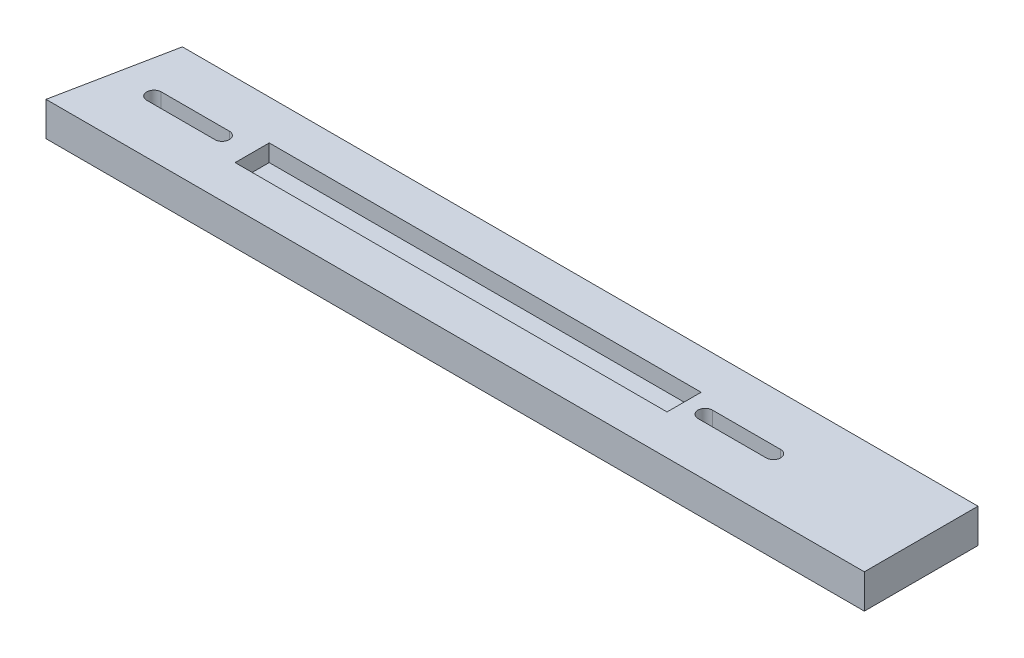
from build123d import *

# Parameters (mm, degrees)
SKETCH1_W           = 457.2
SKETCH1_H           = 63.5
BOSS_EXTRUDE1_DEPTH = 19.05
CUT_EXTRUDE1_DEPTH  = 19.05
CUT_EXTRUDE2_DEPTH  = 232.579198116
SKETCH5_W           = 241.3
SKETCH5_H           = 19.05
CUT_EXTRUDE3_DEPTH  = 9.525


with BuildPart() as part:
    # Sketch1 → Boss-Extrude1 (new body)
    with BuildSketch(Plane(origin=(0, 0, 0), x_dir=(1, 0, 0), z_dir=(0, 1, 0))):
        Rectangle(SKETCH1_W, SKETCH1_H)
    extrude(amount=BOSS_EXTRUDE1_DEPTH)

    # Sketch2 → Cut-Extrude1 (cut)
    with BuildSketch(Plane(origin=(0, 19.05, 0), x_dir=(1, 0, 0), z_dir=(0, 1, 0))):
        with BuildLine():
            Line((146.05, -4.064), (107.95, -4.064))
            ThreePointArc((107.95, -4.064), (103.886, 0), (107.95, 4.064))
            Line((107.95, 4.064), (146.05, 4.064))
            ThreePointArc((146.05, 4.064), (150.114, 0), (146.05, -4.064))
        make_face()
        with BuildLine():
            Line((-200.025, 4.064), (-161.925, 4.064))
            ThreePointArc((-161.925, 4.064), (-157.861, 0), (-161.925, -4.064))
            Line((-161.925, -4.064), (-200.025, -4.064))
            ThreePointArc((-200.025, -4.064), (-204.089, 0), (-200.025, 4.064))
        make_face()
    extrude(amount=-CUT_EXTRUDE1_DEPTH, mode=Mode.SUBTRACT)

    # Sketch3 → Cut-Extrude2 (cut, through all)
    with BuildSketch(Plane(origin=(0, 19.05, 0), x_dir=(1, 0, 0), z_dir=(0, 1, 0))):
        Polygon((-228.6, 31.75), (-228.6, -31.75), (-215.9, 31.75), align=None)
    extrude(amount=-CUT_EXTRUDE2_DEPTH, mode=Mode.SUBTRACT)

    # Sketch5 → Cut-Extrude3 (cut)
    with BuildSketch(Plane(origin=(0, 19.05, 0), x_dir=(1, 0, 0), z_dir=(0, 1, 0))):
        with Locations((-24.511, 0)):
            Rectangle(SKETCH5_W, SKETCH5_H)
    extrude(amount=-CUT_EXTRUDE3_DEPTH, mode=Mode.SUBTRACT)


solid = part.part
